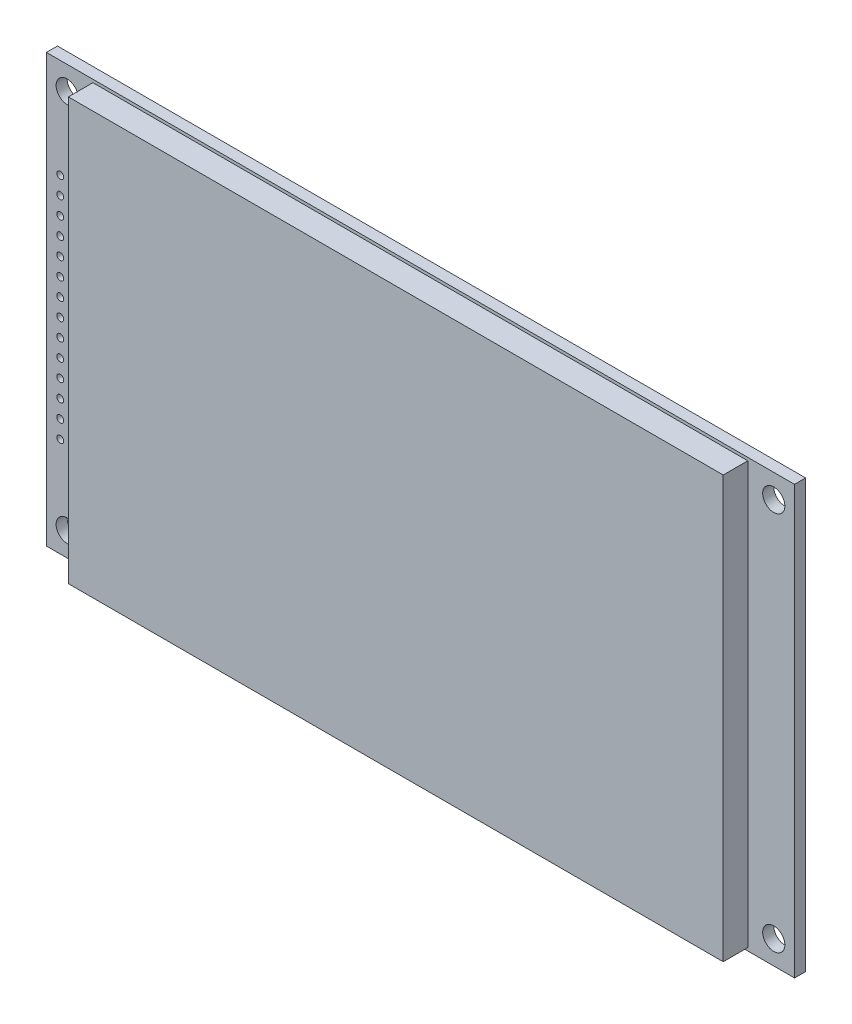
from build123d import *

# Parameters (mm, degrees)
SKETCH1_W              = 108.04
SKETCH1_H              = 61.74
SKETCH1_R              = 1.6
BOSS_EXTRUDE1_DEPTH    = 1.6
SKETCH2_W              = 94.57
SKETCH2_H              = 60.88
BOSS_EXTRUDE2_DEPTH    = 3.55
SKETCH3_R              = 0.5
CUT_EXTRUDE1_DEPTH     = 3.55
SKETCH4_W              = 2
SKETCH4_H              = 35.02
SKETCH4_R              = 0.5
BOSS_EXTRUDE3_DEPTH    = 2.5
SKETCH5_R              = 0.5
BOSS_EXTRUDE4_DEPTH    = 5.84
BOSS_EXTRUDE4_2_DEPTH  = 5.84
BOSS_EXTRUDE4_3_DEPTH  = 5.84
BOSS_EXTRUDE4_4_DEPTH  = 5.84
BOSS_EXTRUDE4_5_DEPTH  = 5.84
BOSS_EXTRUDE4_6_DEPTH  = 5.84
BOSS_EXTRUDE4_7_DEPTH  = 5.84
BOSS_EXTRUDE4_8_DEPTH  = 5.84
BOSS_EXTRUDE4_9_DEPTH  = 5.84
BOSS_EXTRUDE4_10_DEPTH = 5.84
BOSS_EXTRUDE4_11_DEPTH = 5.84
BOSS_EXTRUDE4_12_DEPTH = 5.84
BOSS_EXTRUDE4_13_DEPTH = 5.84
BOSS_EXTRUDE4_14_DEPTH = 5.84


with BuildPart() as part:
    # Sketch1 → Boss-Extrude1 (new body)
    with BuildSketch(Plane.XY):
        Rectangle(SKETCH1_W, SKETCH1_H)
        with Locations((-51.02, 27.45)):
            Circle(SKETCH1_R, mode=Mode.SUBTRACT)
        with Locations((-51.02, -27.45)):
            Circle(SKETCH1_R, mode=Mode.SUBTRACT)
        with Locations((51.02, -27.45)):
            Circle(SKETCH1_R, mode=Mode.SUBTRACT)
        with Locations((51.02, 27.45)):
            Circle(SKETCH1_R, mode=Mode.SUBTRACT)
    extrude(amount=BOSS_EXTRUDE1_DEPTH)

    # Sketch2 → Boss-Extrude2 (add)
    with BuildSketch(Plane.XY.offset(1.6)):
        with Locations((-0.015, 0)):
            Rectangle(SKETCH2_W, SKETCH2_H)
    extrude(amount=BOSS_EXTRUDE2_DEPTH)

    # Sketch3 → Cut-Extrude1 (cut)
    with BuildSketch(Plane.XY.offset(1.6)):
        with Locations((-52.02, 16.51)):
            Circle(SKETCH3_R)
        with Locations((-52.02, 13.97)):
            Circle(SKETCH3_R)
        with Locations((-52.02, 11.43)):
            Circle(SKETCH3_R)
        with Locations((-52.02, 8.89)):
            Circle(SKETCH3_R)
        with Locations((-52.02, 6.35)):
            Circle(SKETCH3_R)
        with Locations((-52.02, 3.81)):
            Circle(SKETCH3_R)
        with Locations((-52.02, 1.27)):
            Circle(SKETCH3_R)
        with Locations((-52.02, -1.27)):
            Circle(SKETCH3_R)
        with Locations((-52.02, -3.81)):
            Circle(SKETCH3_R)
        with Locations((-52.02, -6.35)):
            Circle(SKETCH3_R)
        with Locations((-52.02, -8.89)):
            Circle(SKETCH3_R)
        with Locations((-52.02, -11.43)):
            Circle(SKETCH3_R)
        with Locations((-52.02, -13.97)):
            Circle(SKETCH3_R)
        with Locations((-52.02, -16.51)):
            Circle(SKETCH3_R)
    extrude(amount=-CUT_EXTRUDE1_DEPTH, mode=Mode.SUBTRACT)

    # Sketch4 → Boss-Extrude3 (add)
    with BuildSketch(Plane(origin=(0, 0, 0), x_dir=(-1, 0, 0), z_dir=(0, 0, -1))):
        with Locations((52.02, 0)):
            Rectangle(SKETCH4_W, SKETCH4_H)
        with Locations(Location((52.02, 13.97, 0), (0, 0, 180))):
            Circle(SKETCH4_R, mode=Mode.SUBTRACT)
        with Locations(Location((52.02, 8.89, 0), (0, 0, 180))):
            Circle(SKETCH4_R, mode=Mode.SUBTRACT)
        with Locations(Location((52.02, 3.81, 0), (0, 0, 180))):
            Circle(SKETCH4_R, mode=Mode.SUBTRACT)
        with Locations(Location((52.02, -1.27, 0), (0, 0, 180))):
            Circle(SKETCH4_R, mode=Mode.SUBTRACT)
        with Locations(Location((52.02, -6.35, 0), (0, 0, 180))):
            Circle(SKETCH4_R, mode=Mode.SUBTRACT)
        with Locations(Location((52.02, -11.43, 0), (0, 0, 180))):
            Circle(SKETCH4_R, mode=Mode.SUBTRACT)
        with Locations(Location((52.02, -16.51, 0), (0, 0, 180))):
            Circle(SKETCH4_R, mode=Mode.SUBTRACT)
        with Locations(Location((52.02, -13.97, 0), (0, 0, 180))):
            Circle(SKETCH4_R, mode=Mode.SUBTRACT)
        with Locations(Location((52.02, -8.89, 0), (0, 0, 180))):
            Circle(SKETCH4_R, mode=Mode.SUBTRACT)
        with Locations(Location((52.02, -3.81, 0), (0, 0, 180))):
            Circle(SKETCH4_R, mode=Mode.SUBTRACT)
        with Locations(Location((52.02, 1.27, 0), (0, 0, 180))):
            Circle(SKETCH4_R, mode=Mode.SUBTRACT)
        with Locations(Location((52.02, 6.35, 0), (0, 0, 180))):
            Circle(SKETCH4_R, mode=Mode.SUBTRACT)
        with Locations(Location((52.02, 11.43, 0), (0, 0, 180))):
            Circle(SKETCH4_R, mode=Mode.SUBTRACT)
        with Locations(Location((52.02, 16.51, 0), (0, 0, 180))):
            Circle(SKETCH4_R, mode=Mode.SUBTRACT)
    extrude(amount=BOSS_EXTRUDE3_DEPTH)


with BuildPart() as body_2:
    # Sketch5 → Boss-Extrude4 (new body)
    with BuildSketch(Plane(origin=(0, 0, -2.5), x_dir=(-1, 0, 0), z_dir=(0, 0, -1))):
        with Locations((52.02, -16.51)):
            Circle(SKETCH5_R)
    extrude(amount=BOSS_EXTRUDE4_DEPTH)


with BuildPart() as body_3:
    # Sketch5 → Boss-Extrude4 2 (new body)
    with BuildSketch(Plane(origin=(0, 0, -2.5), x_dir=(-1, 0, 0), z_dir=(0, 0, -1))):
        with Locations((52.02, -13.97)):
            Circle(SKETCH5_R)
    extrude(amount=BOSS_EXTRUDE4_2_DEPTH)


with BuildPart() as body_4:
    # Sketch5 → Boss-Extrude4 3 (new body)
    with BuildSketch(Plane(origin=(0, 0, -2.5), x_dir=(-1, 0, 0), z_dir=(0, 0, -1))):
        with Locations((52.02, -11.43)):
            Circle(SKETCH5_R)
    extrude(amount=BOSS_EXTRUDE4_3_DEPTH)


with BuildPart() as body_5:
    # Sketch5 → Boss-Extrude4 4 (new body)
    with BuildSketch(Plane(origin=(0, 0, -2.5), x_dir=(-1, 0, 0), z_dir=(0, 0, -1))):
        with Locations((52.02, -8.89)):
            Circle(SKETCH5_R)
    extrude(amount=BOSS_EXTRUDE4_4_DEPTH)


with BuildPart() as body_6:
    # Sketch5 → Boss-Extrude4 5 (new body)
    with BuildSketch(Plane(origin=(0, 0, -2.5), x_dir=(-1, 0, 0), z_dir=(0, 0, -1))):
        with Locations((52.02, -6.35)):
            Circle(SKETCH5_R)
    extrude(amount=BOSS_EXTRUDE4_5_DEPTH)


with BuildPart() as body_7:
    # Sketch5 → Boss-Extrude4 6 (new body)
    with BuildSketch(Plane(origin=(0, 0, -2.5), x_dir=(-1, 0, 0), z_dir=(0, 0, -1))):
        with Locations((52.02, -3.81)):
            Circle(SKETCH5_R)
    extrude(amount=BOSS_EXTRUDE4_6_DEPTH)


with BuildPart() as body_8:
    # Sketch5 → Boss-Extrude4 7 (new body)
    with BuildSketch(Plane(origin=(0, 0, -2.5), x_dir=(-1, 0, 0), z_dir=(0, 0, -1))):
        with Locations((52.02, -1.27)):
            Circle(SKETCH5_R)
    extrude(amount=BOSS_EXTRUDE4_7_DEPTH)


with BuildPart() as body_9:
    # Sketch5 → Boss-Extrude4 8 (new body)
    with BuildSketch(Plane(origin=(0, 0, -2.5), x_dir=(-1, 0, 0), z_dir=(0, 0, -1))):
        with Locations((52.02, 1.27)):
            Circle(SKETCH5_R)
    extrude(amount=BOSS_EXTRUDE4_8_DEPTH)


with BuildPart() as body_10:
    # Sketch5 → Boss-Extrude4 9 (new body)
    with BuildSketch(Plane(origin=(0, 0, -2.5), x_dir=(-1, 0, 0), z_dir=(0, 0, -1))):
        with Locations((52.02, 3.81)):
            Circle(SKETCH5_R)
    extrude(amount=BOSS_EXTRUDE4_9_DEPTH)


with BuildPart() as body_11:
    # Sketch5 → Boss-Extrude4 10 (new body)
    with BuildSketch(Plane(origin=(0, 0, -2.5), x_dir=(-1, 0, 0), z_dir=(0, 0, -1))):
        with Locations((52.02, 6.35)):
            Circle(SKETCH5_R)
    extrude(amount=BOSS_EXTRUDE4_10_DEPTH)


with BuildPart() as body_12:
    # Sketch5 → Boss-Extrude4 11 (new body)
    with BuildSketch(Plane(origin=(0, 0, -2.5), x_dir=(-1, 0, 0), z_dir=(0, 0, -1))):
        with Locations((52.02, 8.89)):
            Circle(SKETCH5_R)
    extrude(amount=BOSS_EXTRUDE4_11_DEPTH)


with BuildPart() as body_13:
    # Sketch5 → Boss-Extrude4 12 (new body)
    with BuildSketch(Plane(origin=(0, 0, -2.5), x_dir=(-1, 0, 0), z_dir=(0, 0, -1))):
        with Locations((52.02, 11.43)):
            Circle(SKETCH5_R)
    extrude(amount=BOSS_EXTRUDE4_12_DEPTH)


with BuildPart() as body_14:
    # Sketch5 → Boss-Extrude4 13 (new body)
    with BuildSketch(Plane(origin=(0, 0, -2.5), x_dir=(-1, 0, 0), z_dir=(0, 0, -1))):
        with Locations((52.02, 13.97)):
            Circle(SKETCH5_R)
    extrude(amount=BOSS_EXTRUDE4_13_DEPTH)


with BuildPart() as body_15:
    # Sketch5 → Boss-Extrude4 14 (new body)
    with BuildSketch(Plane(origin=(0, 0, -2.5), x_dir=(-1, 0, 0), z_dir=(0, 0, -1))):
        with Locations((52.02, 16.51)):
            Circle(SKETCH5_R)
    extrude(amount=BOSS_EXTRUDE4_14_DEPTH)


solid = Compound([part.part, body_2.part, body_3.part, body_4.part, body_5.part, body_6.part, body_7.part, body_8.part, body_9.part, body_10.part, body_11.part, body_12.part, body_13.part, body_14.part, body_15.part])
